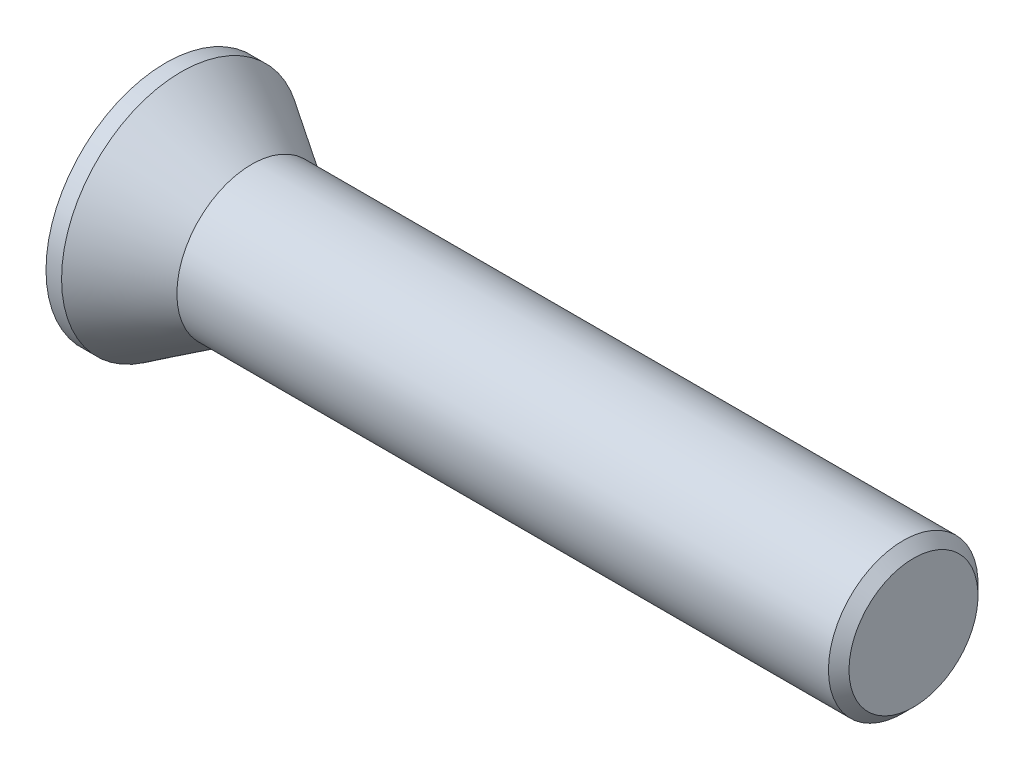
from build123d import *

# Parameters (mm, degrees)
SLOT_DEPTH      = 2.5
SLOT_DEPTH_BACK = 2.5


with BuildPart() as part:
    # BodySke → BaseBody (revolve)
    with BuildSketch(Plane.XY):
        Polygon((0, 0), (0, 16), (2.081886537, 16), (11.5, 10), (98.626, 10), (100, 8.626), (100, 0), align=None)
    revolve(axis=Axis((0, 0, 0), (1, 0, 0)))

    # SlotSke → Slot (cut, two sides: drawn at the far end of the back side and taken through both)
    with BuildSketch(Plane(origin=(0, 0, 0), x_dir=(1, 0, 0), z_dir=(0, 1, 0)).offset(-SLOT_DEPTH_BACK)):
        Polygon((0, 12.5), (4, 9.951718957), (4, -9.951718957), (0, -12.5), align=None)
    extrude(amount=SLOT_DEPTH + SLOT_DEPTH_BACK, mode=Mode.SUBTRACT)


solid = part.part
